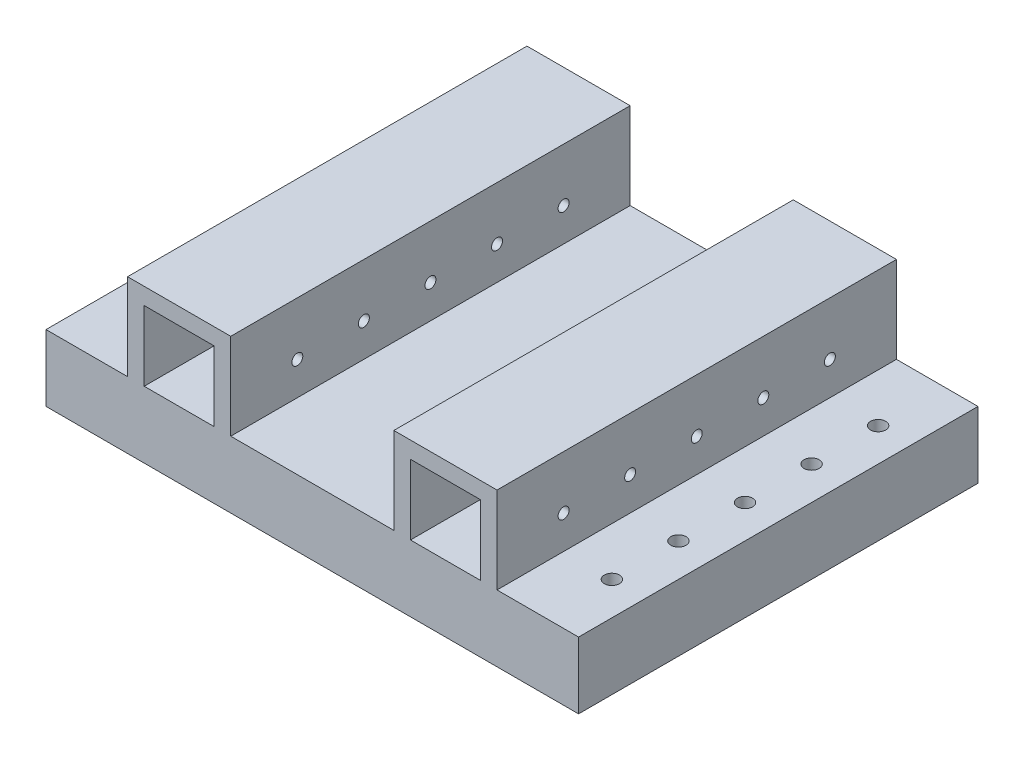
from build123d import *

# Parameters (mm, degrees)
SKETCH_1_W          = 21
SKETCH_1_H          = 21
EXTRUDE_1_DEPTH     = 120
SKETCH_2_W          = 85
SKETCH_2_H          = 74
CUT_EXTRUDE_1_DEPTH = 16
SKETCH_3_R          = 1.65
CUT_EXTRUDE_2_DEPTH = 187.751840687
SKETCH_5_R          = 2.275478237
CUT_EXTRUDE_3_DEPTH = 152.380315761


with BuildPart() as part:
    # 草图1 → 凸台-拉伸1 (new body)
    with BuildSketch(Plane.XY):
        Polygon((-80, 0), (80, 0), (80, 20), (55.5, 20), (55.5, 46), (24.5, 46), (24.5, 20), (-24.5, 20), (-24.5, 46), (-55.5, 46), (-55.5, 20), (-80, 20), align=None)
        with Locations((40, 30.5)):
            Rectangle(SKETCH_1_W, SKETCH_1_H, mode=Mode.SUBTRACT)
        with Locations((-40, 30.5)):
            Rectangle(SKETCH_1_W, SKETCH_1_H, mode=Mode.SUBTRACT)
    extrude(amount=EXTRUDE_1_DEPTH)

    # 草图2 → 切除-拉伸1 (cut)
    with BuildSketch(Plane.XZ):
        with Locations((0, 60)):
            Rectangle(SKETCH_2_W, SKETCH_2_H)
    extrude(amount=-CUT_EXTRUDE_1_DEPTH, mode=Mode.SUBTRACT)

    # 草图3 → 切除-拉伸2 (cut, through all)
    with BuildSketch(Plane.ZY.offset(55.5)):
        with Locations((20, 30)):
            Circle(SKETCH_3_R)
        with Locations((40, 30)):
            Circle(SKETCH_3_R)
        with Locations((60, 30)):
            Circle(SKETCH_3_R)
        with Locations((80, 30)):
            Circle(SKETCH_3_R)
        with Locations((100, 30)):
            Circle(SKETCH_3_R)
    extrude(amount=-CUT_EXTRUDE_2_DEPTH, mode=Mode.SUBTRACT)

    # 草图5 → 切除-拉伸3 (cut, through all)
    with BuildSketch(Plane.XZ):
        with Locations(Location((-70, 100, 0), (0, 0, 270))):
            Circle(SKETCH_5_R)
        with Locations(Location((-70, 80, 0), (0, 0, 270))):
            Circle(SKETCH_5_R)
        with Locations(Location((-70, 60, 0), (0, 0, 270))):
            Circle(SKETCH_5_R)
        with Locations(Location((-70, 40, 0), (0, 0, 270))):
            Circle(SKETCH_5_R)
        with Locations(Location((-70, 20, 0), (0, 0, 270))):
            Circle(SKETCH_5_R)
    cut_extrude_3 = extrude(amount=-CUT_EXTRUDE_3_DEPTH, mode=Mode.SUBTRACT)

    # 镜向1: 切除-拉伸3 across plane
    add(cut_extrude_3.mirror(Plane(origin=(0, 0, 0), x_dir=(0, 0, 1), z_dir=(1, 0, 0))), mode=Mode.SUBTRACT)


solid = part.part
